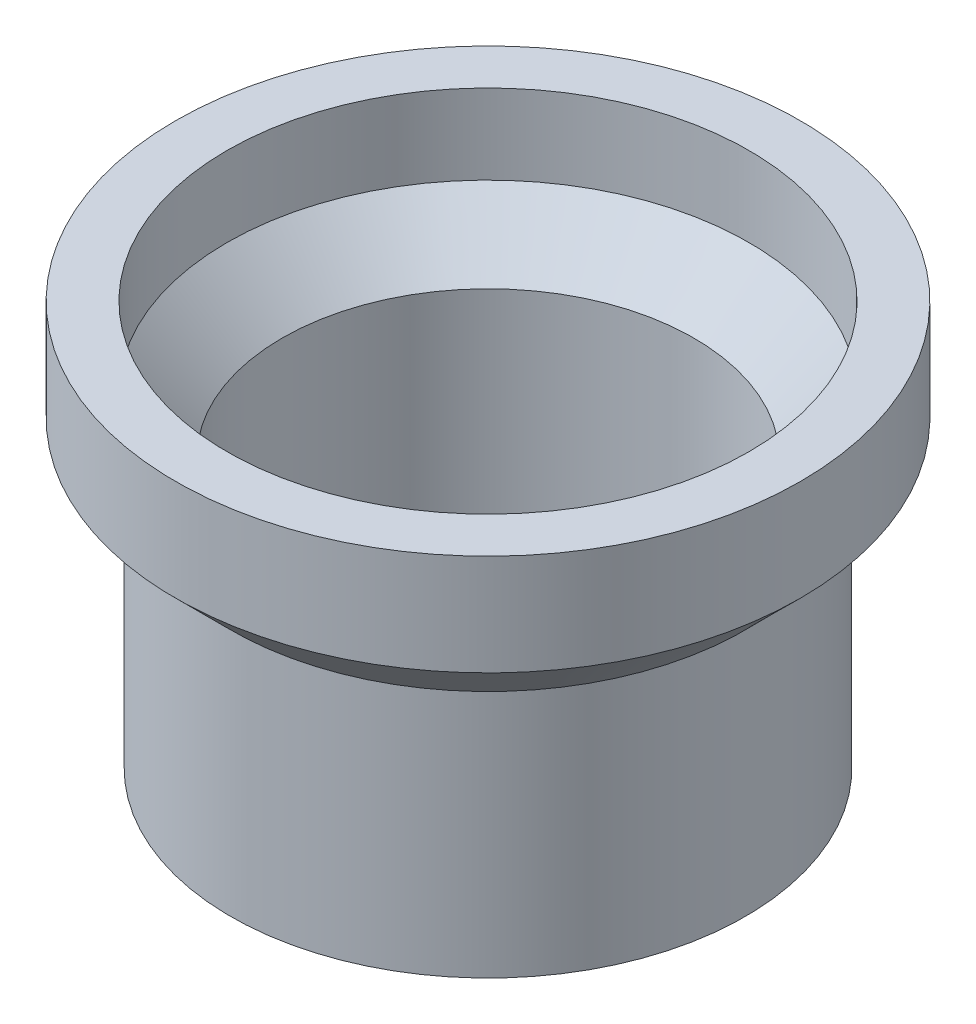
from build123d import *

# Parameters (mm, degrees)
CHAMFER1_SIZE = 2


with BuildPart() as part:
    # Sketch1 → Revolve1 (revolve)
    with BuildSketch(Plane.XY, mode=Mode.PRIVATE) as revolve1_sk:
        Polygon((17, 0), (17, -5.5), (14, -8.5), (14, -22), (11.2, -22), (11.2, -7.340202025), (14.2, -4.340202025), (14.2, 0), align=None)
    revolve(revolve1_sk.sketch.rotate(Axis((0, 16.279491968, 0), (0, -1, 0)), 180), axis=Axis((0, 16.279491968, 0), (0, -1, 0)))

    # Chamfer1
    chamfer1_edges = [part.edges().sort_by_distance(p)[0] for p in [
        (11.2, -22, 0),
    ]]
    chamfer(chamfer1_edges, length=CHAMFER1_SIZE)


solid = part.part
